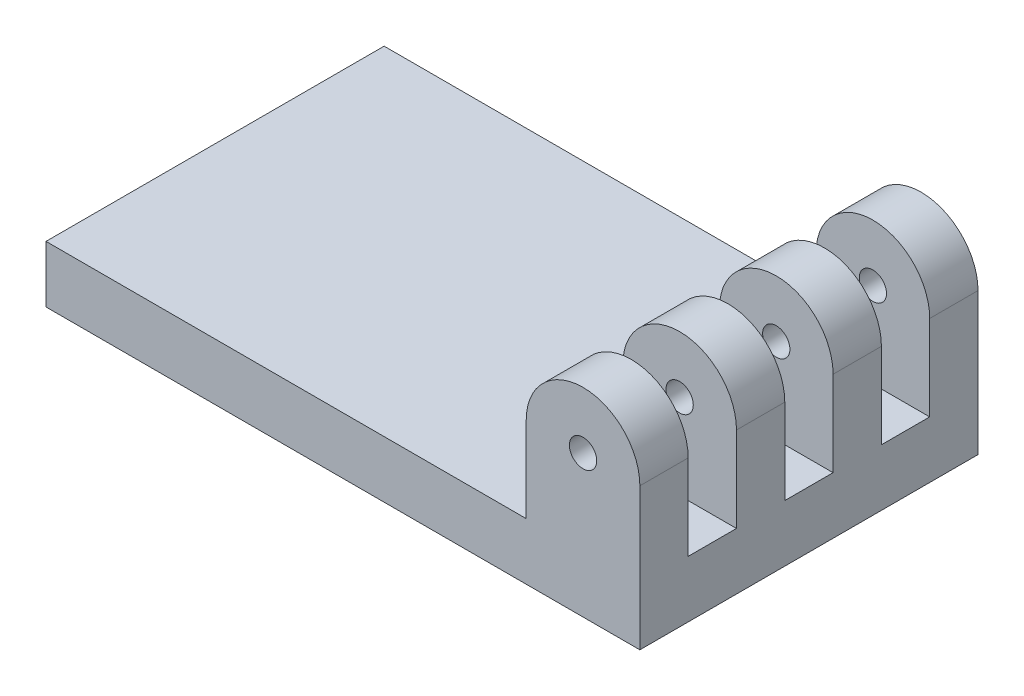
from build123d import *

# Parameters (mm, degrees)
SKETCH1_W                       = 104.5
SKETCH1_H                       = 59.5
BOSS_EXTRUDE1_DEPTH             = 10
BOSS_EXTRUDE2_REACH             = 62.952
BOSS_EXTRUDE2_DIRECTION_2_REACH = 62.952
SKETCH4_W                       = 20
SKETCH4_H                       = 8.5
CUT_EXTRUDE1_DEPTH              = 66.116242213
M4_CLEARANCE_HOLE1_D            = 4.8


with BuildPart() as part:
    # Sketch1 → Boss-Extrude1 (new body)
    with BuildSketch(Plane(origin=(0, 0, 0), x_dir=(1, 0, 0), z_dir=(0, 1, 0))):
        Rectangle(SKETCH1_W, SKETCH1_H)
    extrude(amount=BOSS_EXTRUDE1_DEPTH)

    # Boss-Extrude2: up to this face of the body (flat: up to its plane)
    boss_extrude2_end = Plane(part.part.faces().sort_by_distance((0, 5, 29.75))[0])
    # Sketch3 → Boss-Extrude2 (add, up to the picked face)
    with BuildSketch(Plane.XY, mode=Mode.PRIVATE) as boss_extrude2_sk1:
        with BuildLine():
            Line((52.25, 10), (52.25, 25))
            ThreePointArc((52.25, 25), (42.25, 35), (32.25, 25))
            Line((32.25, 25), (32.25, 10))
            Line((32.25, 10), (52.25, 10))
        make_face()
    boss_extrude2_tool1 = split(extrude(boss_extrude2_sk1.sketch, amount=BOSS_EXTRUDE2_REACH, mode=Mode.PRIVATE), bisect_by=boss_extrude2_end, keep=Keep.BOTH, mode=Mode.PRIVATE)
    add(boss_extrude2_tool1.solids().sort_by(Axis((42.25, 21.535979, 0), (0, 0, 1)))[0])

    # Boss-Extrude2 direction 2: up to this face of the body (flat: up to its plane)
    boss_extrude2_direction_2_end = Plane(part.part.faces().sort_by_distance((0, 5, -29.75))[0])
    # Sketch3 → Boss-Extrude2 direction 2 (add, up to the picked face)
    with BuildSketch(Plane.XY, mode=Mode.PRIVATE) as boss_extrude2_direction_2_sk1:
        with BuildLine():
            Line((52.25, 10), (52.25, 25))
            ThreePointArc((52.25, 25), (42.25, 35), (32.25, 25))
            Line((32.25, 25), (32.25, 10))
            Line((32.25, 10), (52.25, 10))
        make_face()
    boss_extrude2_direction_2_tool1 = split(extrude(boss_extrude2_direction_2_sk1.sketch, amount=-BOSS_EXTRUDE2_DIRECTION_2_REACH, mode=Mode.PRIVATE), bisect_by=boss_extrude2_direction_2_end, keep=Keep.BOTH, mode=Mode.PRIVATE)
    add(boss_extrude2_direction_2_tool1.solids().sort_by(Axis((42.25, 21.535979, 0), (0, 0, -1)))[0])

    # Sketch4 → Cut-Extrude1 (cut, through all)
    with BuildSketch(Plane(origin=(0, 10, 0), x_dir=(1, 0, 0), z_dir=(0, 1, 0))):
        with Locations((42.25, 17)):
            Rectangle(SKETCH4_W, SKETCH4_H)
        with Locations((42.25, 0)):
            Rectangle(SKETCH4_W, SKETCH4_H)
        with Locations((42.25, -17)):
            Rectangle(SKETCH4_W, SKETCH4_H)
    extrude(amount=CUT_EXTRUDE1_DEPTH, mode=Mode.SUBTRACT)

    # M4 Clearance Hole1 (through all)
    with Locations(Plane.XY.offset(29.75)):
        with Locations((42.25, 25)):
            Hole(M4_CLEARANCE_HOLE1_D / 2)


solid = part.part
